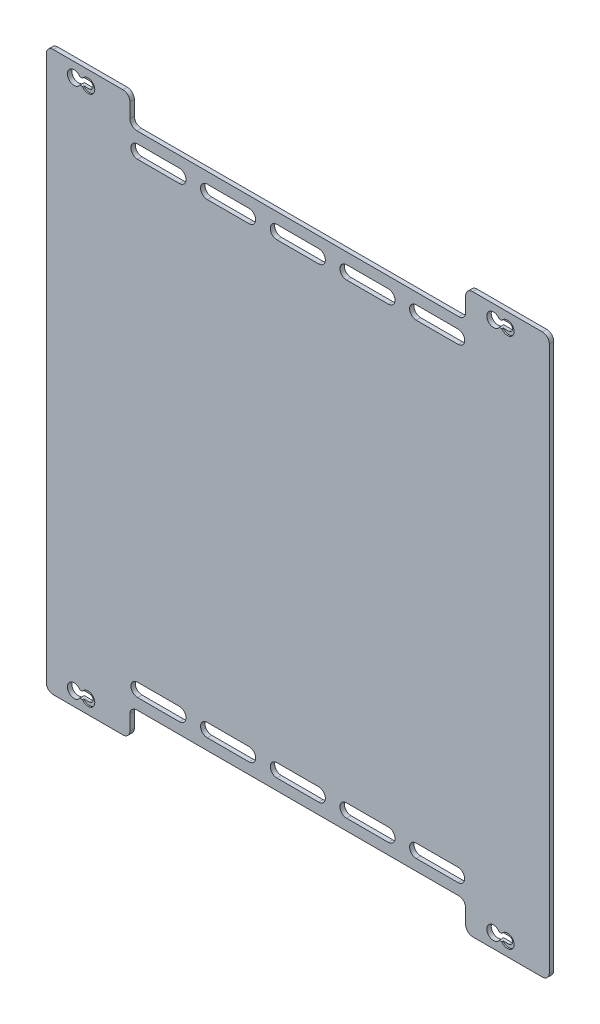
from build123d import *

# Parameters (mm, degrees)
BOSS_EXTRUDE1_DEPTH = 3.175
SKETCH2_R           = 4.8
CUT_EXTRUDE1_DEPTH  = 1
CUT_EXTRUDE2_DEPTH  = 3.175


with BuildPart() as part:
    # Model → Boss-Extrude1 (new body)
    with BuildSketch(Plane.XY):
        with BuildLine():
            Line((175.500000042, 200.504864864), (125.500000042, 200.504864864))
            ThreePointArc((125.500000042, 200.504864864), (121.964466136, 199.04039877), (120.500000042, 195.504864864))
            Line((120.500000042, 195.504864864), (120.500000042, 185.00000269))
            ThreePointArc((120.500000042, 185.00000269), (119.035533948, 181.464468784), (115.500000042, 180.00000269))
            Line((115.500000042, 180.00000269), (-115.500000042, 180.00000269))
            ThreePointArc((-115.500000042, 180.00000269), (-119.035533948, 181.464468784), (-120.500000042, 185.00000269))
            Line((-120.500000042, 185.00000269), (-120.500000042, 195.504864864))
            ThreePointArc((-120.500000042, 195.504864864), (-121.964466136, 199.04039877), (-125.500000042, 200.504864864))
            Line((-125.500000042, 200.504864864), (-175.500000042, 200.504864864))
            ThreePointArc((-175.500000042, 200.504864864), (-179.035533948, 199.04039877), (-180.500000042, 195.504864864))
            Line((-180.500000042, 195.504864864), (-180.500000042, -195.504859484))
            ThreePointArc((-180.500000042, -195.504859484), (-179.035533948, -199.04039339), (-175.500000042, -200.504859484))
            Line((-175.500000042, -200.504859484), (-125.500000042, -200.504859484))
            ThreePointArc((-125.500000042, -200.504859484), (-121.964466136, -199.04039339), (-120.500000042, -195.504859484))
            Line((-120.500000042, -195.504859484), (-120.500000042, -184.99999731))
            ThreePointArc((-120.500000042, -184.99999731), (-119.035533948, -181.464463404), (-115.500000042, -179.99999731))
            Line((-115.500000042, -179.99999731), (115.500000042, -179.99999731))
            ThreePointArc((115.500000042, -179.99999731), (119.035533948, -181.464463404), (120.500000042, -184.99999731))
            Line((120.500000042, -184.99999731), (120.500000042, -195.504864864))
            ThreePointArc((120.500000042, -195.504864864), (121.964466136, -199.04039877), (125.500000042, -200.504864864))
            Line((125.500000042, -200.504864864), (175.500000042, -200.504864864))
            ThreePointArc((175.500000042, -200.504864864), (179.035533948, -199.04039877), (180.500000042, -195.504864864))
            Line((180.500000042, -195.504864864), (180.500000042, 195.504864864))
            ThreePointArc((180.500000042, 195.504864864), (179.035533948, 199.04039877), (175.500000042, 200.504864864))
        make_face()
        with BuildLine():
            Line((144.600753463, 187.915208316), (150.5, 187.915208316))
            ThreePointArc((150.5, 187.915208316), (153.089656548, 190.504864864), (150.5, 193.094521412))
            Line((150.5, 193.094521412), (144.600753463, 193.094521412))
            ThreePointArc((144.600753463, 193.094521412), (135.65, 190.504864864), (144.600753463, 187.915208316))
        make_face(mode=Mode.SUBTRACT)
        with BuildLine():
            Line((150.5, -187.905478588), (144.600753463, -187.905478588))
            ThreePointArc((144.600753463, -187.905478588), (135.65, -190.495135136), (144.600753463, -193.084791684))
            Line((144.600753463, -193.084791684), (150.5, -193.084791684))
            ThreePointArc((150.5, -193.084791684), (153.089656548, -190.495135136), (150.5, -187.905478588))
        make_face(mode=Mode.SUBTRACT)
        with BuildLine():
            Line((-150.5, -187.905478588), (-156.399246537, -187.905478588))
            ThreePointArc((-156.399246537, -187.905478588), (-165.35, -190.495135136), (-156.399246537, -193.084791684))
            Line((-156.399246537, -193.084791684), (-150.5, -193.084791684))
            ThreePointArc((-150.5, -193.084791684), (-147.910343452, -190.495135136), (-150.5, -187.905478588))
        make_face(mode=Mode.SUBTRACT)
        with BuildLine():
            Line((-150.5, 193.094521412), (-156.399246537, 193.094521412))
            ThreePointArc((-156.399246537, 193.094521412), (-165.35, 190.504864864), (-156.399246537, 187.915208316))
            Line((-156.399246537, 187.915208316), (-150.5, 187.915208316))
            ThreePointArc((-150.5, 187.915208316), (-147.910343452, 190.504864864), (-150.5, 193.094521412))
        make_face(mode=Mode.SUBTRACT)
    extrude(amount=BOSS_EXTRUDE1_DEPTH)

    # Sketch2 → Cut-Extrude1 (cut)
    with BuildSketch(Plane.XY.offset(3.175)):
        with Locations((-150.5, 190.504864864)):
            Circle(SKETCH2_R)
        with Locations((150.5, 190.504864864)):
            Circle(SKETCH2_R)
        with Locations((150.5, -190.495135136)):
            Circle(SKETCH2_R)
        with Locations((-150.5, -190.495135136)):
            Circle(SKETCH2_R)
    extrude(amount=-CUT_EXTRUDE1_DEPTH, mode=Mode.SUBTRACT)

    # Sketch3 → Cut-Extrude2 (cut)
    with BuildSketch(Plane.XY.offset(3.175)):
        with BuildLine():
            Line((-15, 162.5), (15, 162.5))
            ThreePointArc((15, 162.5), (19.7625, 167.2625), (15, 172.025))
            Line((15, 172.025), (-15, 172.025))
            ThreePointArc((-15, 172.025), (-19.7625, 167.2625), (-15, 162.5))
        make_face()
        with BuildLine():
            Line((35, 172.025), (65, 172.025))
            ThreePointArc((65, 172.025), (69.7625, 167.2625), (65, 162.5))
            Line((65, 162.5), (35, 162.5))
            ThreePointArc((35, 162.5), (30.2375, 167.2625), (35, 172.025))
        make_face()
        with BuildLine():
            Line((85, 172.025), (115, 172.025))
            ThreePointArc((115, 172.025), (119.7625, 167.2625), (115, 162.5))
            Line((115, 162.5), (85, 162.5))
            ThreePointArc((85, 162.5), (80.2375, 167.2625), (85, 172.025))
        make_face()
        with BuildLine():
            Line((-65, 172.025), (-35, 172.025))
            ThreePointArc((-35, 172.025), (-30.2375, 167.2625), (-35, 162.5))
            Line((-35, 162.5), (-65, 162.5))
            ThreePointArc((-65, 162.5), (-69.7625, 167.2625), (-65, 172.025))
        make_face()
        with BuildLine():
            Line((-115, 172.025), (-85, 172.025))
            ThreePointArc((-85, 172.025), (-80.2375, 167.2625), (-85, 162.5))
            Line((-85, 162.5), (-115, 162.5))
            ThreePointArc((-115, 162.5), (-119.7625, 167.2625), (-115, 172.025))
        make_face()
        with BuildLine():
            Line((-115, -162.5), (-85, -162.5))
            ThreePointArc((-85, -162.5), (-80.2375, -167.2625), (-85, -172.025))
            Line((-85, -172.025), (-115, -172.025))
            ThreePointArc((-115, -172.025), (-119.7625, -167.2625), (-115, -162.5))
        make_face()
        with BuildLine():
            Line((-65, -162.5), (-35, -162.5))
            ThreePointArc((-35, -162.5), (-30.2375, -167.2625), (-35, -172.025))
            Line((-35, -172.025), (-65, -172.025))
            ThreePointArc((-65, -172.025), (-69.7625, -167.2625), (-65, -162.5))
        make_face()
        with BuildLine():
            Line((85, -162.5), (115, -162.5))
            ThreePointArc((115, -162.5), (119.7625, -167.2625), (115, -172.025))
            Line((115, -172.025), (85, -172.025))
            ThreePointArc((85, -172.025), (80.2375, -167.2625), (85, -162.5))
        make_face()
        with BuildLine():
            Line((35, -162.5), (65, -162.5))
            ThreePointArc((65, -162.5), (69.7625, -167.2625), (65, -172.025))
            Line((65, -172.025), (35, -172.025))
            ThreePointArc((35, -172.025), (30.2375, -167.2625), (35, -162.5))
        make_face()
        with BuildLine():
            Line((-15, -172.025), (15, -172.025))
            ThreePointArc((15, -172.025), (19.7625, -167.2625), (15, -162.5))
            Line((15, -162.5), (-15, -162.5))
            ThreePointArc((-15, -162.5), (-19.7625, -167.2625), (-15, -172.025))
        make_face()
    extrude(amount=-CUT_EXTRUDE2_DEPTH, mode=Mode.SUBTRACT)


solid = part.part
